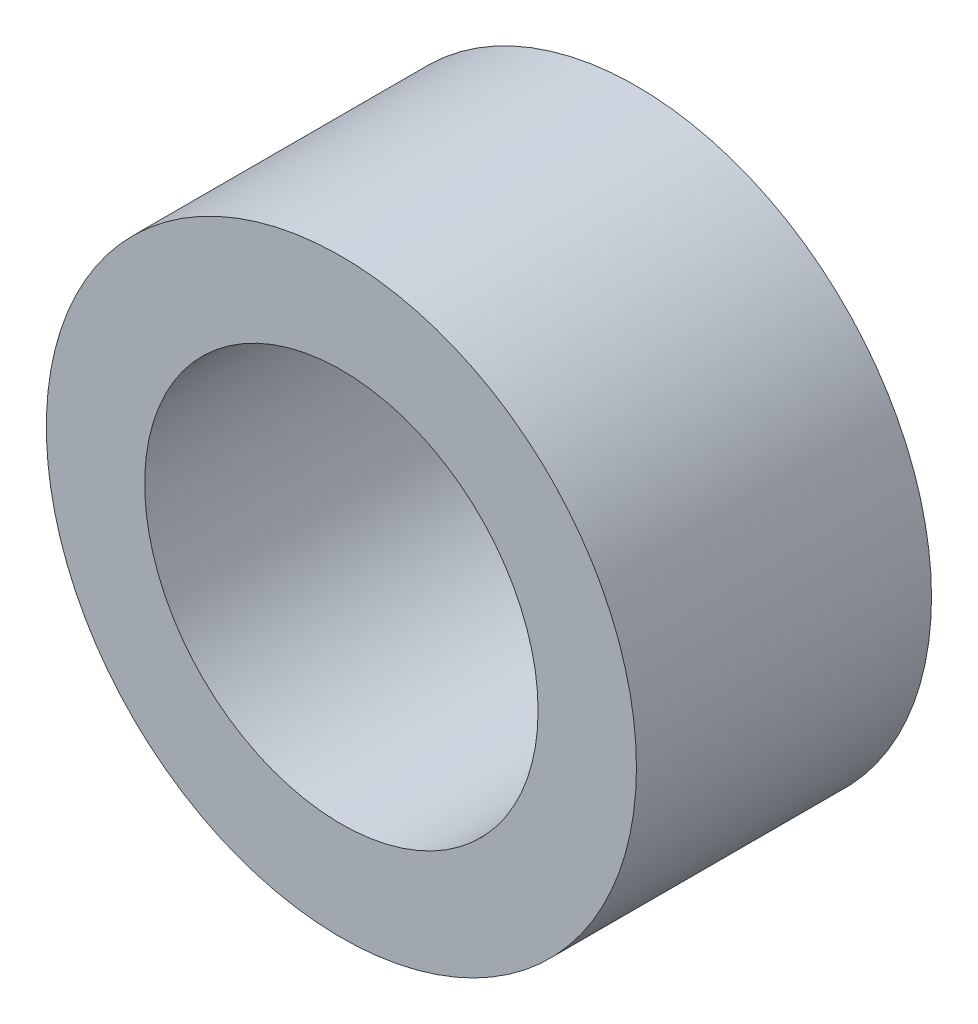
from build123d import *

# Parameters (mm, degrees)
SKETCH_1_R      = 6
SKETCH_1_R_2    = 4
EXTRUDE_1_DEPTH = 6


with BuildPart() as part:
    # 草图1 → 凸台-拉伸1 (new body)
    with BuildSketch(Plane.XY):
        Circle(SKETCH_1_R)
        Circle(SKETCH_1_R_2, mode=Mode.SUBTRACT)
    extrude(amount=EXTRUDE_1_DEPTH)


solid = part.part
